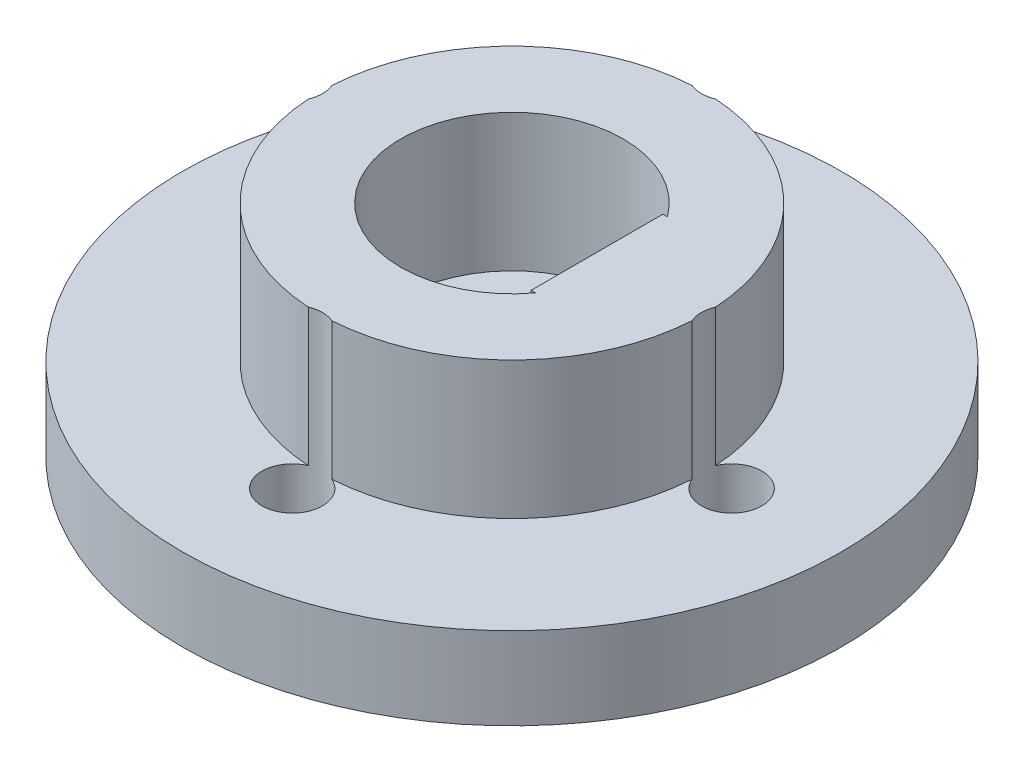
from build123d import *

# Parameters (mm, degrees)
STOCK_HORN_DRIVE_FLANGE_START       = 40
STOCK_HORN_DRIVE_FLANGE_PROFILE_R   = 12
STOCK_HORN_DRIVE_FLANGE_PROFILE_R_2 = 1.75
STOCK_HORN_DRIVE_FLANGE_DEPTH       = 3
D_COUPLING_RING_START               = 43
D_COUPLING_RING_PROFILE_R           = 7
D_COUPLING_RING_PROFILE_R_2         = 4.05
D_COUPLING_RING_DEPTH               = 5
D_KEY_LAND_START                    = 43
D_KEY_LAND_PROFILE_W                = 2.9
D_KEY_LAND_PROFILE_H                = 4.8
D_KEY_LAND_DEPTH                    = 5
STOCK_HORN_SCREWS_START             = 39
STOCK_HORN_SCREWS_PROFILE_R         = 1.1
STOCK_HORN_SCREWS_DEPTH             = 12.911688245


with BuildPart() as part:
    # Stock_horn_drive_flange_profile → Stock_horn_drive_flange (new body)
    with BuildSketch(Plane(origin=(0, 0, 0), x_dir=(1, 0, 0), z_dir=(0, 1, 0)).offset(STOCK_HORN_DRIVE_FLANGE_START)):
        with Locations(Location((0, 0, 0), (0, 0, 270))):
            Circle(STOCK_HORN_DRIVE_FLANGE_PROFILE_R)
        with Locations(Location((0, 0, 0), (0, 0, 270))):
            Circle(STOCK_HORN_DRIVE_FLANGE_PROFILE_R_2, mode=Mode.SUBTRACT)
    extrude(amount=STOCK_HORN_DRIVE_FLANGE_DEPTH)

    # D_coupling_ring_profile → D_coupling_ring (add)
    with BuildSketch(Plane(origin=(0, 0, 0), x_dir=(1, 0, 0), z_dir=(0, 1, 0)).offset(D_COUPLING_RING_START)):
        with Locations(Location((0, 0, 0), (0, 0, 270))):
            Circle(D_COUPLING_RING_PROFILE_R)
        with Locations(Location((0, 0, 0), (0, 0, 270))):
            Circle(D_COUPLING_RING_PROFILE_R_2, mode=Mode.SUBTRACT)
    extrude(amount=D_COUPLING_RING_DEPTH)

    # D_key_land_profile → D_key_land (add)
    with BuildSketch(Plane(origin=(0, 0, 0), x_dir=(1, 0, 0), z_dir=(0, 1, 0)).offset(D_KEY_LAND_START)):
        with Locations((4.55, 0)):
            Rectangle(D_KEY_LAND_PROFILE_W, D_KEY_LAND_PROFILE_H)
    extrude(amount=D_KEY_LAND_DEPTH)

    # Stock_horn_screws_profile → Stock_horn_screws (cut, through all)
    with BuildSketch(Plane(origin=(0, 0, 0), x_dir=(1, 0, 0), z_dir=(0, 1, 0)).offset(STOCK_HORN_SCREWS_START)):
        with Locations(Location((-8, 0, 0), (0, 0, 22.9239414))):
            Circle(STOCK_HORN_SCREWS_PROFILE_R)
        with Locations(Location((8, 0, 0), (0, 0, 157.0760586))):
            Circle(STOCK_HORN_SCREWS_PROFILE_R)
        with Locations(Location((0, -8, 0), (0, 0, 67.0760586))):
            Circle(STOCK_HORN_SCREWS_PROFILE_R)
        with Locations(Location((0, 8, 0), (0, 0, 292.9239414))):
            Circle(STOCK_HORN_SCREWS_PROFILE_R)
    extrude(amount=STOCK_HORN_SCREWS_DEPTH, mode=Mode.SUBTRACT)


solid = part.part
